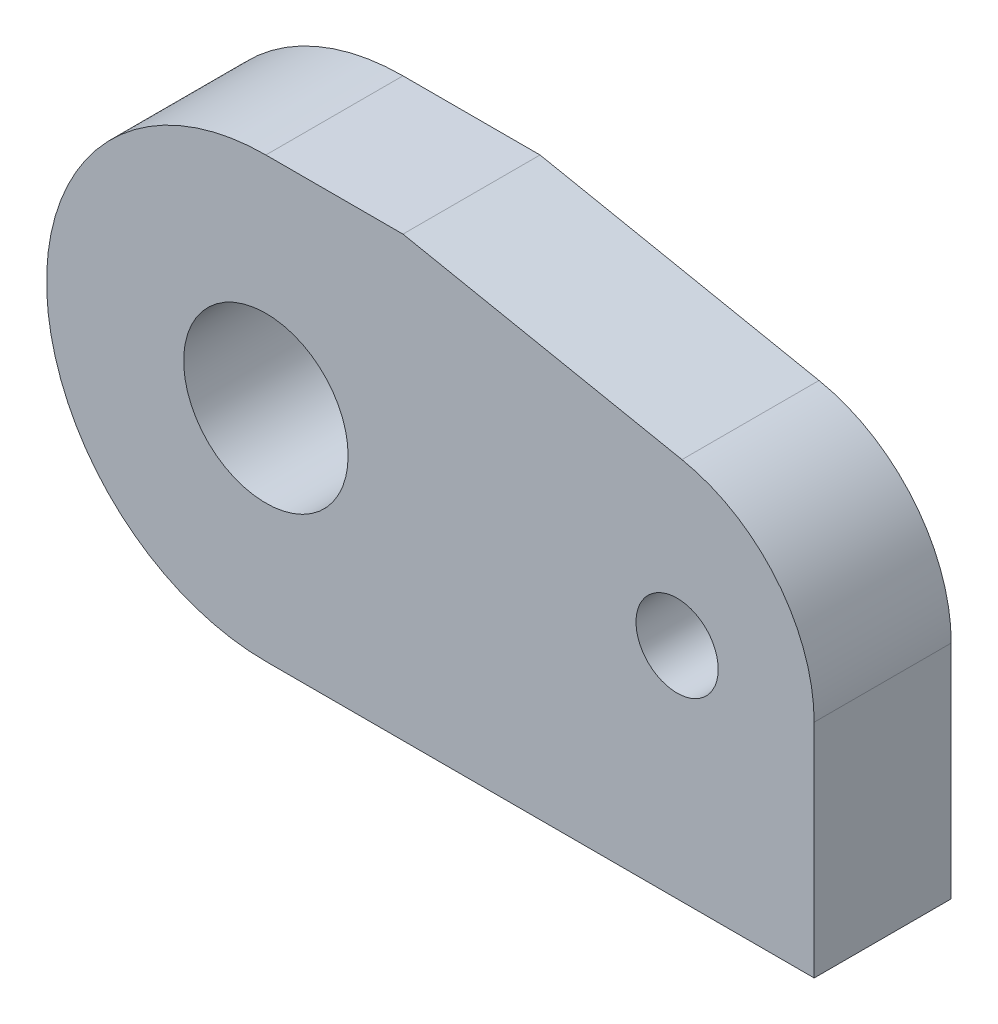
from build123d import *

# Parameters (mm, degrees)
ESQUISSE1_R        = 3
ESQUISSE1_R_2      = 1.5
BOSS_EXTRU_1_DEPTH = 5
CONG_1_R           = 6


with BuildPart() as part:
    # Esquisse1 → Boss.-Extru.1 (new body)
    with BuildSketch(Plane.XY):
        with BuildLine():
            Line((0, 8), (5, 8))
            Line((5, 8), (20, 5))
            Line((20, 5), (20, -8))
            Line((20, -8), (0, -8))
            ThreePointArc((0, -8), (-8, 0), (0, 8))
        make_face()
        Circle(ESQUISSE1_R, mode=Mode.SUBTRACT)
        with Locations((15, 0)):
            Circle(ESQUISSE1_R_2, mode=Mode.SUBTRACT)
    extrude(amount=BOSS_EXTRU_1_DEPTH)

    # Congé1
    cong_1_edges = [part.edges().sort_by_distance(p)[0] for p in [
        (20, 5, 2.5),
    ]]
    fillet(cong_1_edges, radius=CONG_1_R)


solid = part.part
